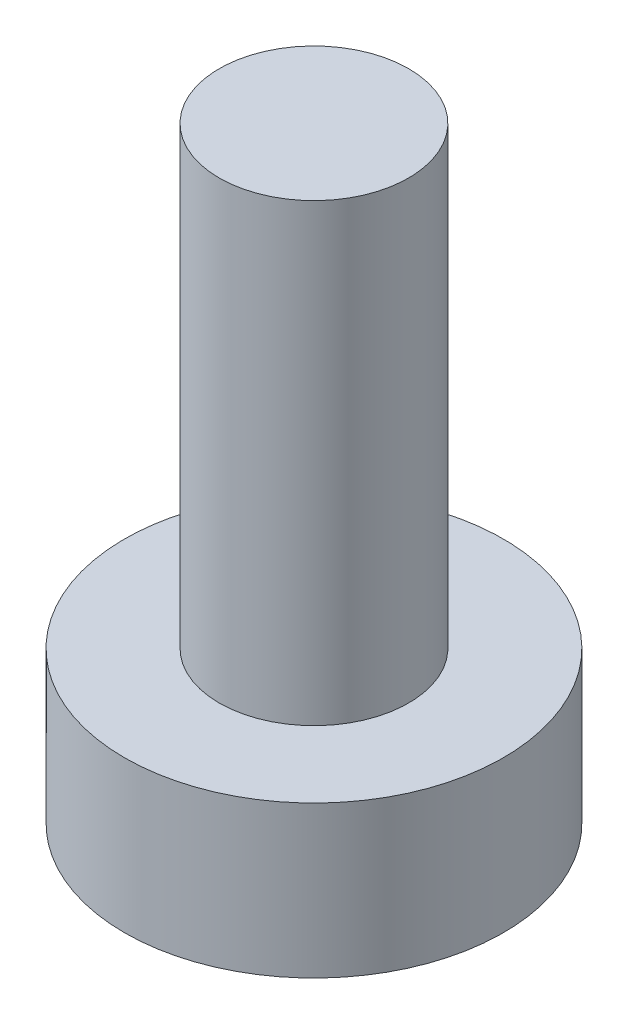
from build123d import *

# Parameters (mm, degrees)
SKETCH_1_R          = 5
EXTRUDE_1_DEPTH     = 4
SKETCH_2_R          = 2.5
EXTRUDE_2_DEPTH     = 12
CUT_EXTRUDE_1_DEPTH = 1


with BuildPart() as part:
    # 草图1 → 凸台-拉伸1 (new body)
    with BuildSketch(Plane(origin=(0, 0, 0), x_dir=(1, 0, 0), z_dir=(0, 1, 0))):
        with Locations(Location((0, 0, 0), (0, 0, 270))):
            Circle(SKETCH_1_R)
    extrude(amount=EXTRUDE_1_DEPTH)

    # 草图2 → 凸台-拉伸2 (add)
    with BuildSketch(Plane(origin=(0, 4, 0), x_dir=(1, 0, 0), z_dir=(0, 1, 0))):
        with Locations(Location((0, 0, 0), (0, 0, 270))):
            Circle(SKETCH_2_R)
    extrude(amount=EXTRUDE_2_DEPTH)

    # 草图3 → 切除-拉伸1 (cut)
    with BuildSketch(Plane.XZ):
        Polygon((-3.464101615, 0), (-1.732050808, -3), (1.732050808, -3), (3.464101615, 0), (1.732050808, 3), (-1.732050808, 3), align=None)
    extrude(amount=-CUT_EXTRUDE_1_DEPTH, mode=Mode.SUBTRACT)


solid = part.part
